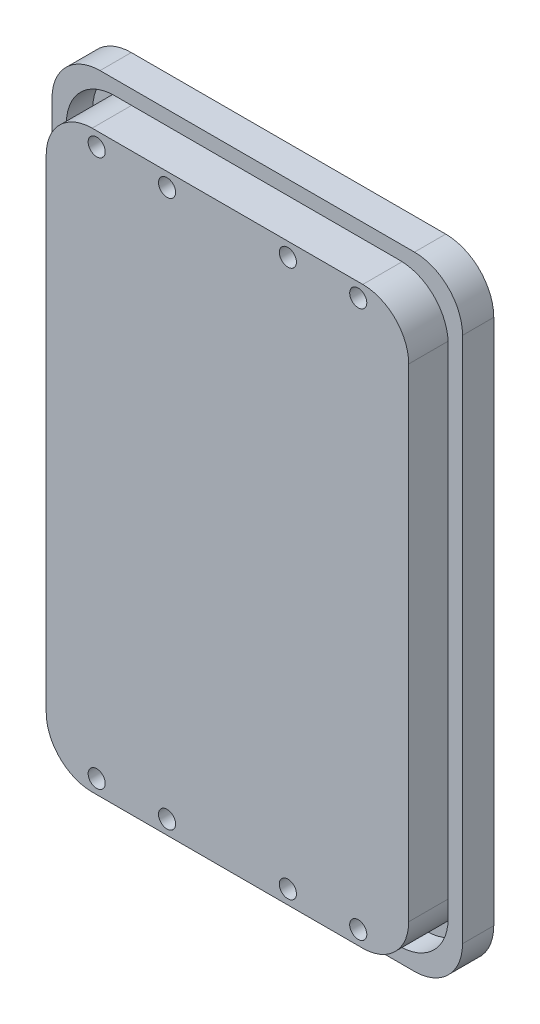
from build123d import *

# Parameters (mm, degrees)
EXTRUDE_2_DEPTH     = 6.5
EXTRUDE_3_DEPTH     = 12.7
EXTRUDE_4_DEPTH     = 1
SKETCH_5_R          = 1.78
CUT_EXTRUDE_1_DEPTH = 79.649667514


with BuildPart() as part:
    # basis → 凸台-拉伸2 (new body)
    with BuildSketch(Plane.XY):
        with BuildLine():
            Line((32.71, 64.81), (-32.71, 64.81))
            ThreePointArc((-32.71, 64.81), (-39.781067812, 61.881067812), (-42.71, 54.81))
            Line((-42.71, 54.81), (-42.71, -54.81))
            ThreePointArc((-42.71, -54.81), (-39.781067812, -61.881067812), (-32.71, -64.81))
            Line((-32.71, -64.81), (32.71, -64.81))
            ThreePointArc((32.71, -64.81), (39.781067812, -61.881067812), (42.71, -54.81))
            Line((42.71, -54.81), (42.71, 54.81))
            ThreePointArc((42.71, 54.81), (39.781067812, 61.881067812), (32.71, 64.81))
        make_face()
        with BuildLine():
            ThreePointArc((-39.71, 51.81), (-36.781067812, 58.881067812), (-29.71, 61.81))
            Line((-29.71, 61.81), (29.71, 61.81))
            ThreePointArc((29.71, 61.81), (36.781067812, 58.881067812), (39.71, 51.81))
            Line((39.71, 51.81), (39.71, -51.81))
            ThreePointArc((39.71, -51.81), (36.781067812, -58.881067812), (29.71, -61.81))
            Line((29.71, -61.81), (-29.71, -61.81))
            ThreePointArc((-29.71, -61.81), (-36.781067812, -58.881067812), (-39.71, -51.81))
            Line((-39.71, -51.81), (-39.71, 51.81))
        make_face(mode=Mode.SUBTRACT)
    extrude(amount=EXTRUDE_2_DEPTH)



with BuildPart() as body_2:
    # basis<4> → 凸台-拉伸3 (new body)
    with BuildSketch(Plane.XY):
        with BuildLine():
            Line((28.1566, 59.81), (-28.1566, 59.81))
            ThreePointArc((-28.1566, 59.81), (-34.911873923, 57.011873923), (-37.71, 50.2566))
            Line((-37.71, 50.2566), (-37.71, -50.2566))
            ThreePointArc((-37.71, -50.2566), (-34.911873923, -57.011873923), (-28.1566, -59.81))
            Line((-28.1566, -59.81), (28.1566, -59.81))
            ThreePointArc((28.1566, -59.81), (34.911873923, -57.011873923), (37.71, -50.2566))
            Line((37.71, -50.2566), (37.71, 50.2566))
            ThreePointArc((37.71, 50.2566), (34.911873923, 57.011873923), (28.1566, 59.81))
        make_face()
    extrude(amount=EXTRUDE_3_DEPTH)


with BuildPart() as part_1:
    add(part.part)

    add(body_2.part)  # 凸台-拉伸4 merges body 2
    # basis<5> → 凸台-拉伸4 (add)
    with BuildSketch(Plane.XY):
        with BuildLine():
            Line((29.71, 61.81), (-29.71, 61.81))
            ThreePointArc((-29.71, 61.81), (-36.781067812, 58.881067812), (-39.71, 51.81))
            Line((-39.71, 51.81), (-39.71, -51.81))
            ThreePointArc((-39.71, -51.81), (-36.781067812, -58.881067812), (-29.71, -61.81))
            Line((-29.71, -61.81), (29.71, -61.81))
            ThreePointArc((29.71, -61.81), (36.781067812, -58.881067812), (39.71, -51.81))
            Line((39.71, -51.81), (39.71, 51.81))
            ThreePointArc((39.71, 51.81), (36.781067812, 58.881067812), (29.71, 61.81))
        make_face()
        with BuildLine():
            ThreePointArc((-37.71, 50.2566), (-34.911873923, 57.011873923), (-28.1566, 59.81))
            Line((-28.1566, 59.81), (28.1566, 59.81))
            ThreePointArc((28.1566, 59.81), (34.911873923, 57.011873923), (37.71, 50.2566))
            Line((37.71, 50.2566), (37.71, -50.2566))
            ThreePointArc((37.71, -50.2566), (34.911873923, -57.011873923), (28.1566, -59.81))
            Line((28.1566, -59.81), (-28.1566, -59.81))
            ThreePointArc((-28.1566, -59.81), (-34.911873923, -57.011873923), (-37.71, -50.2566))
            Line((-37.71, -50.2566), (-37.71, 50.2566))
        make_face(mode=Mode.SUBTRACT)
    extrude(amount=EXTRUDE_4_DEPTH)

    # 草图5 → 切除-拉伸1 (cut, through all)
    with BuildSketch(Plane(origin=(0, 0, 0), x_dir=(-1, 0, 0), z_dir=(0, 0, -1))):
        with Locations((27.21, 56.91)):
            Circle(SKETCH_5_R)
        with Locations((12.57, 56.91)):
            Circle(SKETCH_5_R)
        with Locations((-12.57, 56.91)):
            Circle(SKETCH_5_R)
        with Locations((-27.21, 56.91)):
            Circle(SKETCH_5_R)
        with Locations((27.21, -56.91)):
            Circle(SKETCH_5_R)
        with Locations((12.57, -56.91)):
            Circle(SKETCH_5_R)
        with Locations((-12.57, -56.91)):
            Circle(SKETCH_5_R)
        with Locations((-27.21, -56.91)):
            Circle(SKETCH_5_R)
    extrude(amount=-CUT_EXTRUDE_1_DEPTH, mode=Mode.SUBTRACT)


solid = part_1.part
